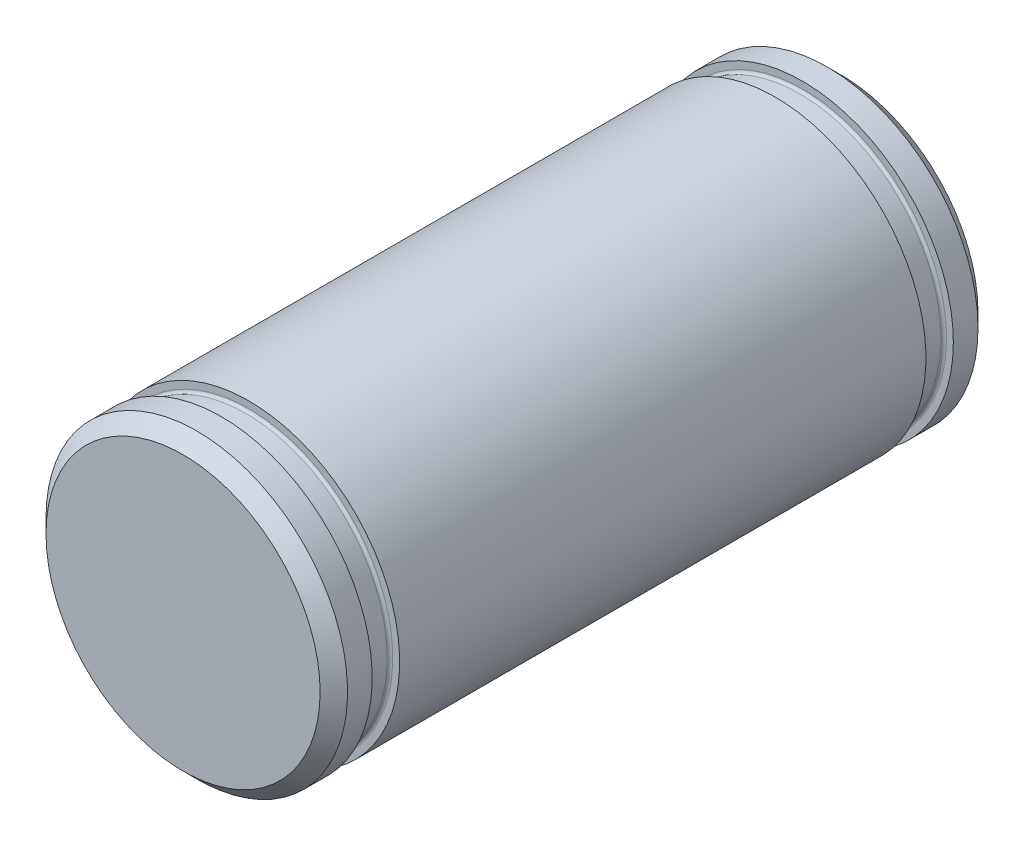
from build123d import *

# Parameters (mm, degrees)
ESQUISSE1_R      = 5.5
EXTRUSION1_DEPTH = 12
CHANFREIN1_SIZE  = 0.5
CHANFREIN2_SIZE  = 0.5


with BuildPart() as part:
    # Esquisse1 → Extrusion1 (new, symmetric)
    with BuildSketch(Plane.XY):
        Circle(ESQUISSE1_R)
    extrude(amount=EXTRUSION1_DEPTH, both=True)

    # Chanfrein1
    chanfrein1_edges = [part.edges().sort_by_distance(p)[0] for p in [
        (-5.5, 0, 12),
    ]]
    chamfer(chanfrein1_edges, length=CHANFREIN1_SIZE)

    # Chanfrein2
    chanfrein2_edges = [part.edges().sort_by_distance(p)[0] for p in [
        (-5.5, 0, -12),
    ]]
    chamfer(chanfrein2_edges, length=CHANFREIN2_SIZE)

    # Esquisse3 → Gorge pour ANSI B27.8M - 3DM1-11, Circlip haut rendement1 (revolve, cut)
    with BuildSketch(Plane(origin=(0, 0, 24), x_dir=(0, 1, 0), z_dir=(-1, 0, 0)), mode=Mode.PRIVATE) as gorge_pour_ansi_b27_8m_3dm1_11_circli_sk:
        with BuildLine():
            Line((5.25, 13.4), (6.6, 13.4))
            Line((6.6, 13.4), (6.6, 14.4))
            Line((6.6, 14.4), (5.25, 14.4))
            ThreePointArc((5.25, 14.4), (5.179289322, 14.370710678), (5.15, 14.3))
            Line((5.15, 14.3), (5.15, 13.5))
            ThreePointArc((5.15, 13.5), (5.179289322, 13.429289322), (5.25, 13.4))
        make_face()
    gorge_pour_ansi_b27_8m_3dm1_11_circli = revolve(gorge_pour_ansi_b27_8m_3dm1_11_circli_sk.sketch.rotate(Axis((0, 0, 74), (0, 0, -1)), 270), axis=Axis((0, 0, 74), (0, 0, -1)), mode=Mode.SUBTRACT)

    # Symétrie1: Gorge pour ANSI B27.8M - 3DM1-11, Circlip haut rendement1 across plane
    add(gorge_pour_ansi_b27_8m_3dm1_11_circli.mirror(Plane.XY), mode=Mode.SUBTRACT)


solid = part.part
